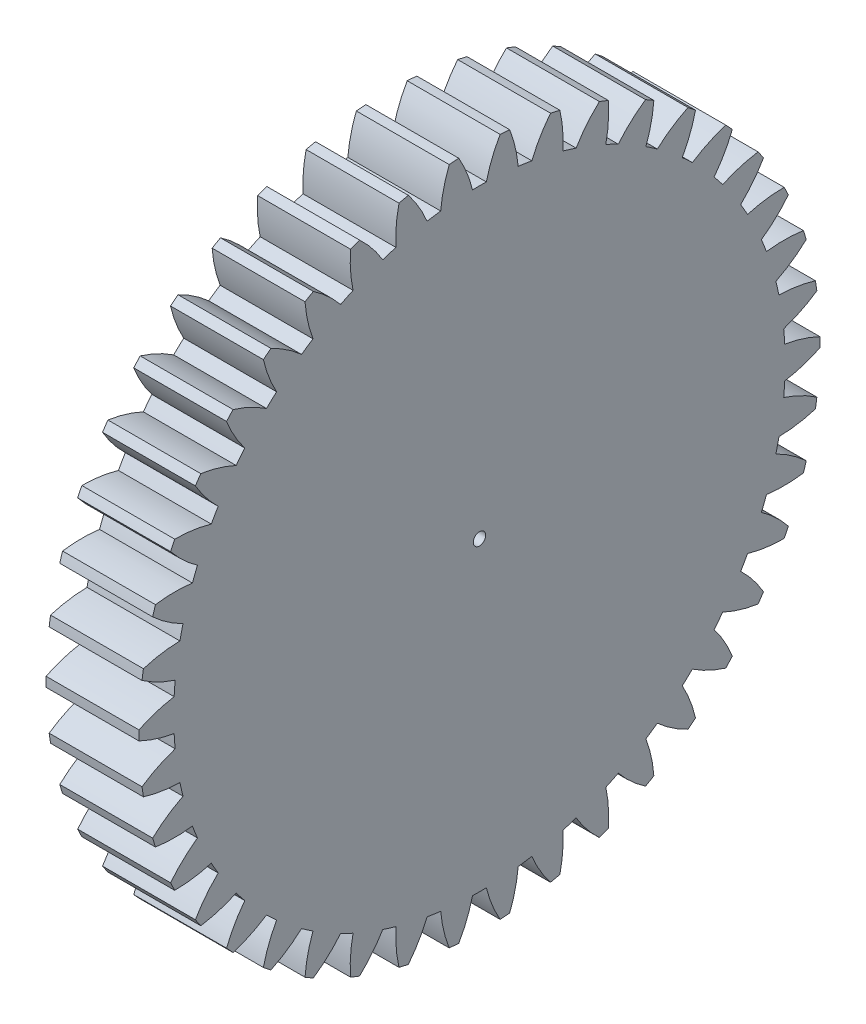
from build123d import *

# Parameters (mm, degrees)
BASPROSKE_W     = 6
BASPROSKE_H     = 22
TOOTHCUT_DEPTH  = 32.685959036
TEETHCUTS_COUNT = 42
TEETHCUTS_ANGLE = 351.428571429
BORSKE_R        = 0.4
BORE_DEPTH      = 50.0000508


with BuildPart() as part:
    # BasProSke → Base-Revolve (revolve)
    with BuildSketch(Plane(origin=(0, 0, 0), x_dir=(1, 0, 0), z_dir=(0, 1, 0)), mode=Mode.PRIVATE) as base_revolve_sk:
        with Locations((3, 11)):
            Rectangle(BASPROSKE_W, BASPROSKE_H)
    revolve(base_revolve_sk.sketch.rotate(Axis((-10, 0, 0), (1, 0, 0)), 180), axis=Axis((-10, 0, 0), (1, 0, 0)))

    # TooCutSke → ToothCut (cut, through all)
    with BuildSketch(Plane(origin=(0, 0, 0), x_dir=(0, 0, -1), z_dir=(1, 0, 0))):
        with BuildLine():
            ThreePointArc((0.446078735, 19.743961476), (0, 19.749), (-0.446078735, 19.743961476))
            ThreePointArc((-0.446078735, 19.743961476), (-0.816459964, 20.896623713), (-1.348697399, 21.984068333))
            ThreePointArc((-1.348697399, 21.984068333), (0, 22.0254), (1.348697399, 21.984068333))
            ThreePointArc((1.348697399, 21.984068333), (0.816459964, 20.896623713), (0.446078735, 19.743961476))
        make_face()
    toothcut = extrude(amount=TOOTHCUT_DEPTH, mode=Mode.SUBTRACT)

    # TeethCuts: ToothCut ×42 about axis
    teethcuts_axis = Axis((-10, 0, 0), (1, 0, 0))
    for i in range(1, TEETHCUTS_COUNT):
        add(toothcut.rotate(teethcuts_axis, i * TEETHCUTS_ANGLE / (TEETHCUTS_COUNT - 1)), mode=Mode.SUBTRACT)

    # BorSke → Bore (cut, symmetric)
    with BuildSketch(Plane(origin=(0, 0, 0), x_dir=(0, 0, -1), z_dir=(1, 0, 0))):
        with Locations(Location((0, 0, 0), (0, 0, 180))):
            Circle(BORSKE_R)
    extrude(amount=BORE_DEPTH, both=True, mode=Mode.SUBTRACT)


solid = part.part
